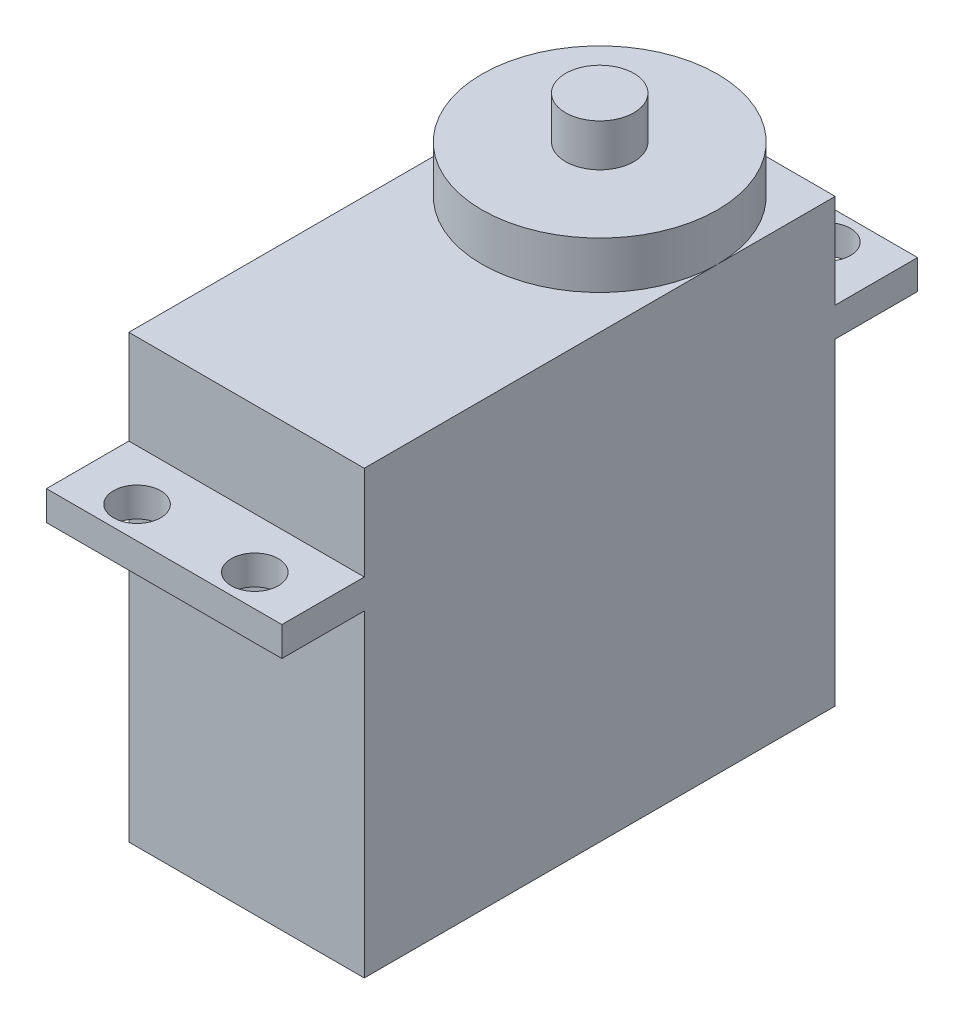
from build123d import *

# Parameters (mm, degrees)
SKETCH_1_W          = 20
SKETCH_1_H          = 40
EXTRUDE_1_DEPTH     = 27
SKETCH_2_W          = 20
SKETCH_2_H          = 54
EXTRUDE_2_DEPTH     = 2.5
SKETCH_3_W          = 20
SKETCH_3_H          = 40
EXTRUDE_3_DEPTH     = 8
SKETCH_4_R          = 2
CUT_EXTRUDE_1_DEPTH = 42.221960167
SKETCH_5_R          = 10
EXTRUDE_4_DEPTH     = 4
SKETCH_6_R          = 2.9
EXTRUDE_5_DEPTH     = 3.6


with BuildPart() as part:
    # 草图1 → 凸台-拉伸1 (new body)
    with BuildSketch(Plane(origin=(0, 0, 0), x_dir=(1, 0, 0), z_dir=(0, 1, 0))):
        Rectangle(SKETCH_1_W, SKETCH_1_H)
    extrude(amount=EXTRUDE_1_DEPTH)

    # 草图2 → 凸台-拉伸2 (add)
    with BuildSketch(Plane(origin=(0, 27, 0), x_dir=(1, 0, 0), z_dir=(0, 1, 0))):
        Rectangle(SKETCH_2_W, SKETCH_2_H)
    extrude(amount=EXTRUDE_2_DEPTH)

    # 草图3 → 凸台-拉伸3 (add)
    with BuildSketch(Plane(origin=(0, 29.5, 0), x_dir=(1, 0, 0), z_dir=(0, 1, 0))):
        Rectangle(SKETCH_3_W, SKETCH_3_H)
    extrude(amount=EXTRUDE_3_DEPTH)

    # 草图4 → 切除-拉伸1 (cut, through all)
    with BuildSketch(Plane(origin=(0, 29.5, 0), x_dir=(1, 0, 0), z_dir=(0, 1, 0))):
        with Locations(Location((-5, -24.3, 0), (0, 0, 270))):
            Circle(SKETCH_4_R)
        with Locations(Location((5, -24.3, 0), (0, 0, 270))):
            Circle(SKETCH_4_R)
        with Locations(Location((-5, 24.3, 0), (0, 0, 270))):
            Circle(SKETCH_4_R)
        with Locations(Location((5, 24.3, 0), (0, 0, 270))):
            Circle(SKETCH_4_R)
    extrude(amount=-CUT_EXTRUDE_1_DEPTH, mode=Mode.SUBTRACT)

    # 草图5 → 凸台-拉伸4 (add)
    with BuildSketch(Plane(origin=(0, 37.5, 0), x_dir=(1, 0, 0), z_dir=(0, 1, 0))):
        with Locations(Location((0, 10, 0), (0, 0, 90))):
            Circle(SKETCH_5_R)
    extrude(amount=EXTRUDE_4_DEPTH)

    # 草图6 → 凸台-拉伸5 (add)
    with BuildSketch(Plane(origin=(0, 41.5, 0), x_dir=(1, 0, 0), z_dir=(0, 1, 0))):
        with Locations(Location((0, 10, 0), (0, 0, 270))):
            Circle(SKETCH_6_R)
    extrude(amount=EXTRUDE_5_DEPTH)


solid = part.part
